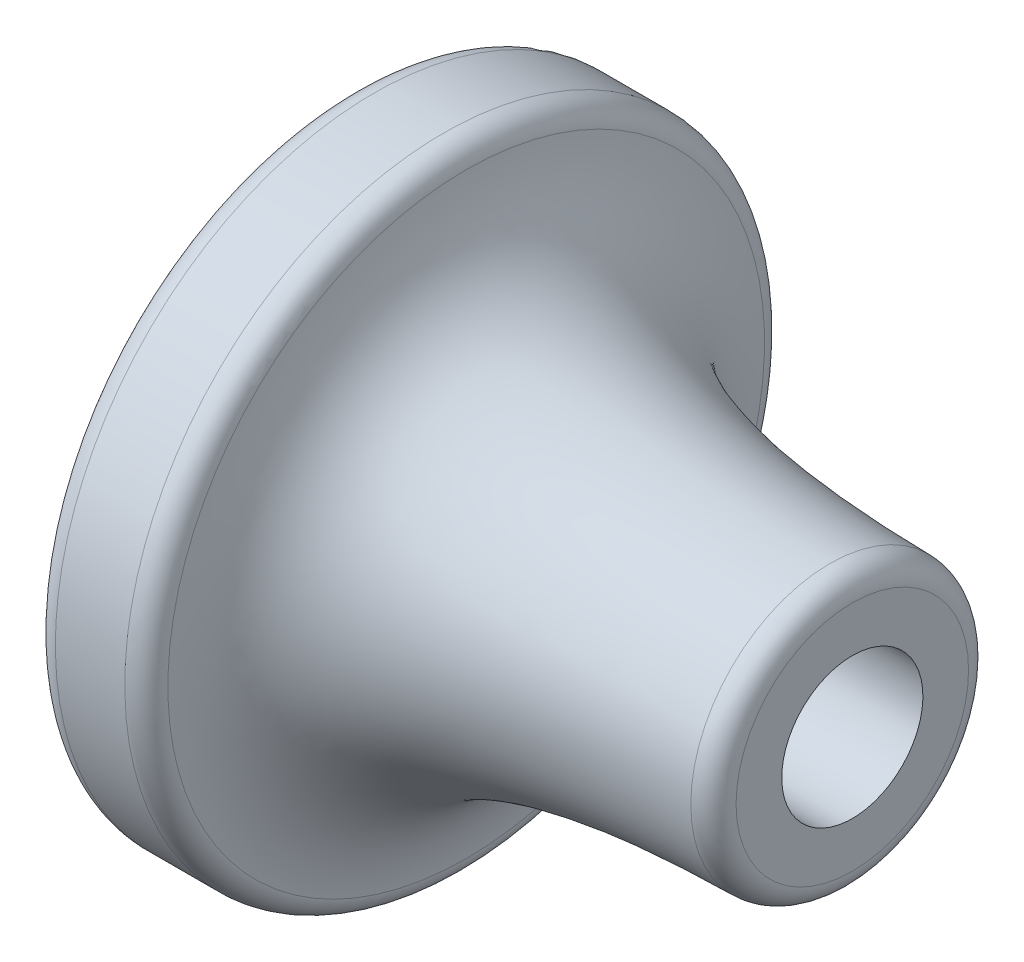
from build123d import *

# Parameters (mm, degrees)
FILLET1_R = 1


with BuildPart() as part:
    # Sketch1 → Revolve1 (revolve)
    with BuildSketch(Plane.XY):
        with BuildLine():
            Line((0, 0), (0, 3.1))
            Line((0, 3.1), (14, 3.1))
            Line((14, 3.1), (14, 6.1))
            add(Edge.make_bspline(
                [(-3, 14), (-3, 8.867369014), (0.961422575, 6.1), (14, 6.1)],
                knots=[0, 0, 0, 0, 1, 1, 1, 1], degree=3))
            Line((-3, 14), (-8, 14))
            Line((-8, 14), (-8, 0))
            Line((-8, 0), (0, 0))
        make_face()
    revolve(axis=Axis((0, 0, 0), (-1, 0, 0)))

    # Fillet1
    fillet1_edges = [part.edges().sort_by_distance(p)[0] for p in [
        (14, -6.1, 0),
        (-3, -14, 0),
        (-8, -14, 0),
    ]]
    fillet(fillet1_edges, radius=FILLET1_R)


solid = part.part
